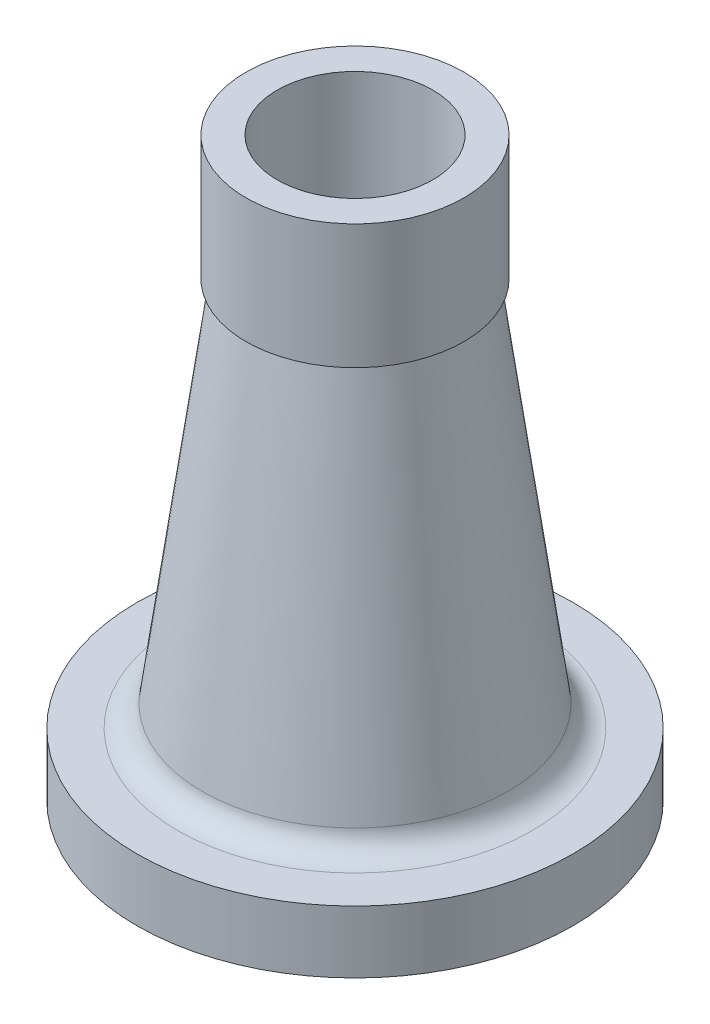
from build123d import *

# Parameters (mm, degrees)
FILLET1_R = 8
FILLET2_R = 1


with BuildPart() as part:
    # Sketch2 → Revolve2 (revolve)
    with BuildSketch(Plane.XY, mode=Mode.PRIVATE) as revolve2_sk:
        Polygon((50, 0), (70, 0), (70, 20), (50, 20), (33, 145), (35, 145), (35, 185), (25, 185), (25, 129.61723322), (42.219943718, 3), (50, 3), align=None)
    revolve(revolve2_sk.sketch.rotate(Axis((0, 0, 0), (0, 1, 0)), 90), axis=Axis((0, 0, 0), (0, 1, 0)))

    # Fillet1
    fillet1_edges = [part.edges().sort_by_distance(p)[0] for p in [
        (0, 20, 50),
    ]]
    fillet(fillet1_edges, radius=FILLET1_R)

    # Fillet2
    fillet2_edges = [part.edges().sort_by_distance(p)[0] for p in [
        (0, 145, 33),
    ]]
    fillet(fillet2_edges, radius=FILLET2_R)


solid = part.part
